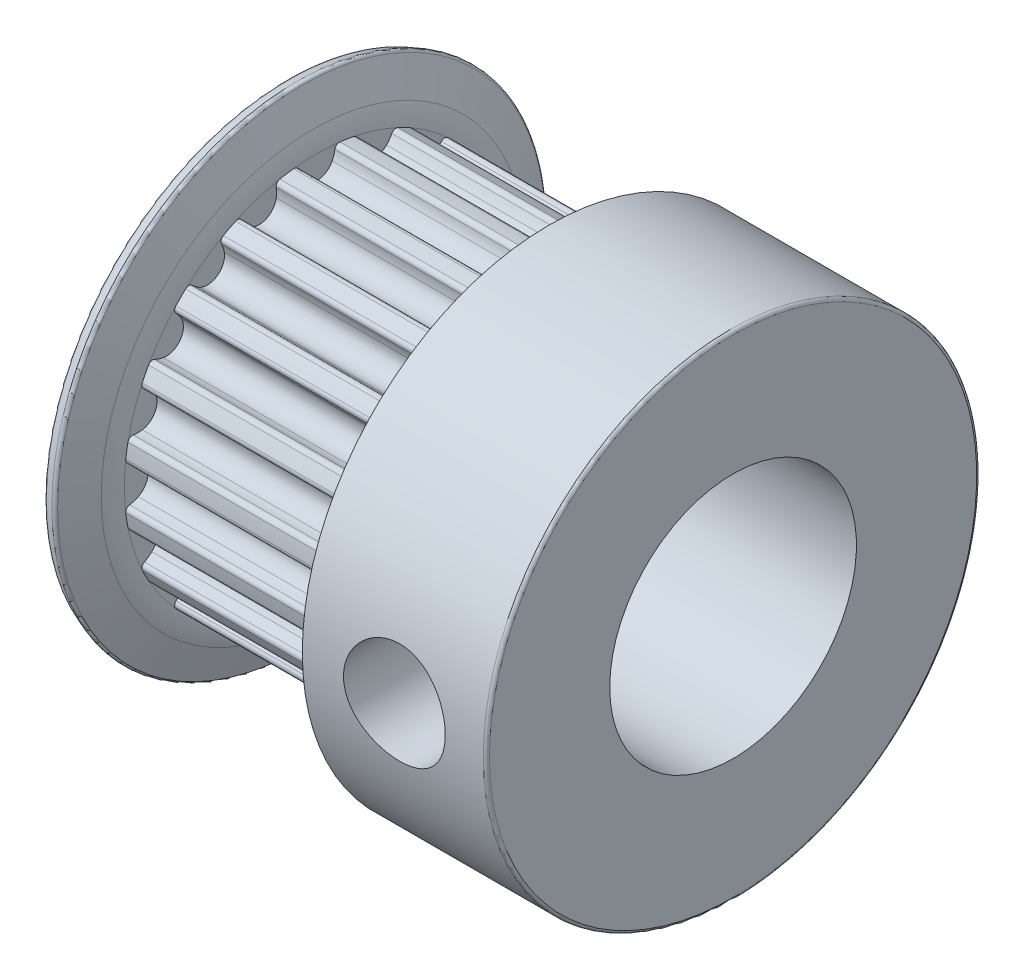
from build123d import *

# Parameters (mm, degrees)
SKETCH1_R           = 6.239197724
SKETCH1_R_2         = 4
BOSS_EXTRUDE1_DEPTH = 3.5
CUT_EXTRUDE1_DEPTH  = 3.5
CIRPATTERN1_COUNT   = 20
FILLET1_R           = 0.1
SKETCH6_W           = 1.65
SKETCH6_H           = 8


with BuildPart() as part:
    # Sketch1 → Boss-Extrude1 (new, symmetric)
    with BuildSketch(Plane(origin=(0, 0, 0), x_dir=(0, 0, -1), z_dir=(1, 0, 0))):
        Circle(SKETCH1_R)
        Circle(SKETCH1_R_2, mode=Mode.SUBTRACT)
    extrude(amount=BOSS_EXTRUDE1_DEPTH, both=True)

    # Sketch2 → Cut-Extrude1 (cut, symmetric)
    with BuildSketch(Plane(origin=(0, 0, 0), x_dir=(0, 0, -1), z_dir=(1, 0, 0))):
        with BuildLine():
            ThreePointArc((0.753665766, 6.19351081), (0, 6.239197724), (-0.753665766, 6.19351081))
            ThreePointArc((-0.753665766, 6.19351081), (-0.645307166, 6.164429342), (-0.587431713, 6.068316129))
            ThreePointArc((-0.587431713, 6.068316129), (-0.553499569, 5.924967979), (-0.498876404, 5.788160113))
            ThreePointArc((-0.498876404, 5.788160113), (0, 5.47636236), (0.498876404, 5.788160113))
            ThreePointArc((0.498876404, 5.788160113), (0.553499569, 5.924967979), (0.587431713, 6.068316129))
            ThreePointArc((0.587431713, 6.068316129), (0.645307166, 6.164429342), (0.753665766, 6.19351081))
        make_face()
    cut_extrude1 = extrude(amount=CUT_EXTRUDE1_DEPTH, both=True, mode=Mode.SUBTRACT)

    # CirPattern1: Cut-Extrude1 ×20 about axis
    cirpattern1_axis = Axis((0, 0, 0), (1, 0, 0))
    for i in range(1, CIRPATTERN1_COUNT):
        add(cut_extrude1.rotate(cirpattern1_axis, i * 360 / CIRPATTERN1_COUNT), mode=Mode.SUBTRACT)

    # Sketch3 → Revolve1 (revolve)
    with BuildSketch(Plane.XY, mode=Mode.PRIVATE) as revolve1_sk:
        with BuildLine():
            Line((-3.5, 4), (-3.5, 6.239197724))
            ThreePointArc((-3.5, 6.239197724), (-3.528735027, 6.562092031), (-3.614036981, 6.874837953))
            Line((-3.614036981, 6.874837953), (-4.03118248, 8))
            Line((-4.03118248, 8), (-4.5, 7.826189375))
            Line((-4.5, 7.826189375), (-4.082854501, 6.701027328))
            ThreePointArc((-4.082854501, 6.701027328), (-4.020877669, 6.473799222), (-4, 6.239197724))
            Line((-4, 6.239197724), (-4, 5))
            Line((-4, 5), (-4.25, 5))
            Line((-4.25, 5), (-4.25, 4.5))
            Line((-4.25, 4.5), (-4.5, 4.5))
            Line((-4.5, 4.5), (-4.5, 4))
            Line((-4.5, 4), (-3.5, 4))
        make_face()
        with BuildLine():
            Line((4.5, 4.5), (4.5, 4))
            Line((4.5, 4), (3.5, 4))
            Line((3.5, 4), (3.5, 6.239197724))
            ThreePointArc((3.5, 6.239197724), (3.528735027, 6.562092031), (3.614036981, 6.874837953))
            Line((3.614036981, 6.874837953), (4.03118248, 8))
            Line((4.03118248, 8), (4.5, 7.826189375))
            Line((4.5, 7.826189375), (4.082854501, 6.701027328))
            ThreePointArc((4.082854501, 6.701027328), (4.020877669, 6.473799222), (4, 6.239197724))
            Line((4, 6.239197724), (4, 5))
            Line((4, 5), (4.25, 5))
            Line((4.25, 5), (4.25, 4.5))
            Line((4.25, 4.5), (4.5, 4.5))
        make_face()
    revolve(revolve1_sk.sketch.rotate(Axis((0, 0, 0), (1, 0, 0)), 90), axis=Axis((0, 0, 0), (1, 0, 0)))

    # Sketch4 → Revolve2 (revolve)
    with BuildSketch(Plane.XY, mode=Mode.PRIVATE) as revolve2_sk:
        Polygon((4.03118248, 8), (10, 8), (10, 4), (3.821551363, 4), align=None)
    revolve(revolve2_sk.sketch.rotate(Axis((0, 0, 0), (1, 0, 0)), 90), axis=Axis((0, 0, 0), (1, 0, 0)))

    # Fillet1
    fillet1_edges = [part.edges().sort_by_distance(p)[0] for p in [
        (-4.03118248, 0, -8),
        (-4.5, 0, -7.826189375),
        (-4, 0, -5),
        (-4.25, 0, -5),
        (-4.25, 0, -4.5),
        (10, 0, -8),
    ]]
    fillet(fillet1_edges, radius=FILLET1_R)

    # Sketch6 → M4 Tapped Hole1 (revolve, cut)
    with BuildSketch(Plane.YZ.offset(7.01559124)):
        with Locations((0.825, 4)):
            Rectangle(SKETCH6_W, SKETCH6_H)
    revolve(axis=Axis((7.01559124, 0, -6.35), (0, 0, 1)), mode=Mode.SUBTRACT)


solid = part.part
